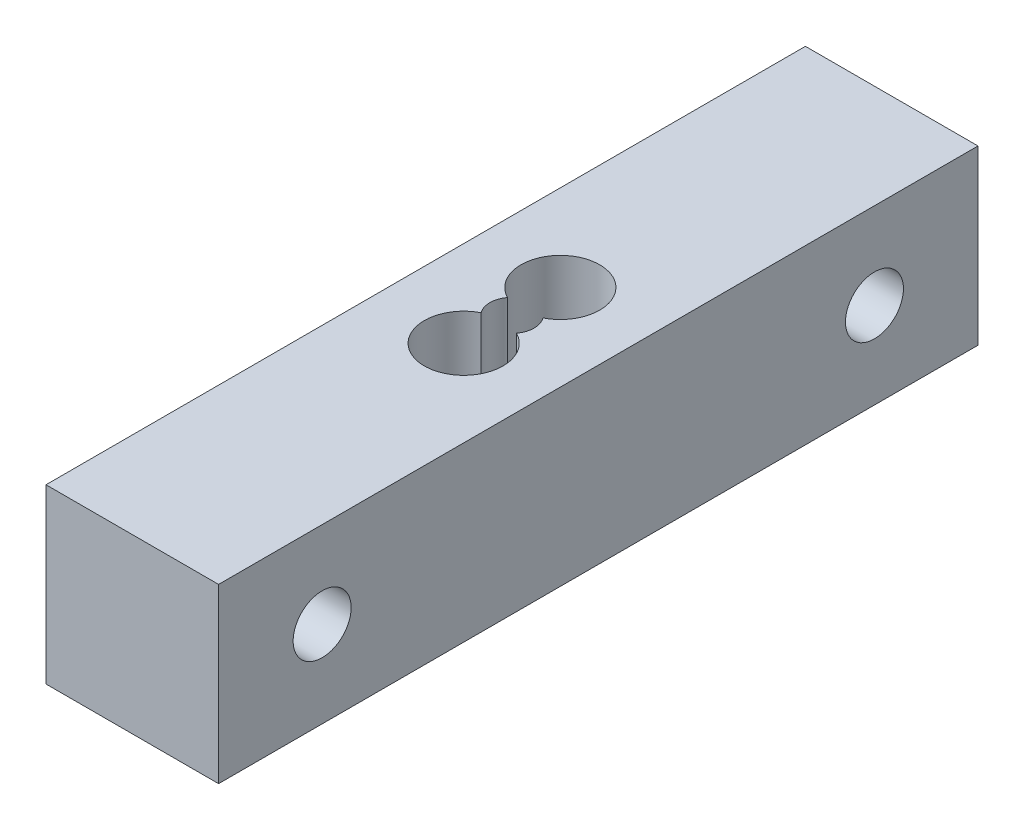
from build123d import *

# Parameters (mm, degrees)
ESQUISSE1_W                  = 12.5
ESQUISSE1_H                  = 12.5
BOSS_EXTRU_1_DEPTH           = 27.5
ENL_V_MAT_EXTRU_1_DEPTH      = 29.885550021
ENL_V_MAT_EXTRU_1_DEPTH_BACK = 29.885550021
ESQUISSE2_R                  = 2.85
ENL_V_MAT_EXTRU_2_DEPTH      = 29.885550021
ENL_V_MAT_EXTRU_2_DEPTH_BACK = 29.885550021
ESQUISSE3_R                  = 1.6
ENL_V_MAT_EXTRU_3_DEPTH      = 29.885550021
ENL_V_MAT_EXTRU_3_DEPTH_BACK = 29.885550021
ESQUISSE4_R                  = 2.1


with BuildPart() as part:
    # Esquisse1 → Boss.-Extru.1 (new, symmetric)
    with BuildSketch(Plane.XY):
        Rectangle(ESQUISSE1_W, ESQUISSE1_H)
    extrude(amount=BOSS_EXTRU_1_DEPTH, both=True)

    # Esquisse2 → Enlèv. mat.-Extru.1 (cut, two sides: drawn at the far end of the back side and taken through both)
    with BuildSketch(Plane(origin=(0, 0, 0), x_dir=(1, 0, 0), z_dir=(0, 1, 0)).offset(-ENL_V_MAT_EXTRU_1_DEPTH_BACK)):
        with Locations(Location((0, 3.5, 0), (0, 0, 270))):
            Circle(ESQUISSE2_R)
        with Locations(Location((0, -3.5, 0), (0, 0, 270))):
            Circle(ESQUISSE2_R)
    extrude(amount=ENL_V_MAT_EXTRU_1_DEPTH + ENL_V_MAT_EXTRU_1_DEPTH_BACK, mode=Mode.SUBTRACT)

    # Esquisse3 → Enlèv. mat.-Extru.2 (cut, two sides: drawn at the far end of the back side and taken through both)
    with BuildSketch(Plane(origin=(0, 0, 0), x_dir=(1, 0, 0), z_dir=(0, 1, 0)).offset(-ENL_V_MAT_EXTRU_2_DEPTH_BACK)):
        Circle(ESQUISSE3_R)
    extrude(amount=ENL_V_MAT_EXTRU_2_DEPTH + ENL_V_MAT_EXTRU_2_DEPTH_BACK, mode=Mode.SUBTRACT)

    # Esquisse4 → Enlèv. mat.-Extru.3 (cut, two sides: drawn at the far end of the back side and taken through both)
    with BuildSketch(Plane(origin=(0, 0, 0), x_dir=(0, 0, -1), z_dir=(1, 0, 0)).offset(-ENL_V_MAT_EXTRU_3_DEPTH_BACK)):
        with Locations((-20, 0)):
            Circle(ESQUISSE4_R)
        with Locations((20, 0)):
            Circle(ESQUISSE4_R)
    extrude(amount=ENL_V_MAT_EXTRU_3_DEPTH + ENL_V_MAT_EXTRU_3_DEPTH_BACK, mode=Mode.SUBTRACT)


solid = part.part
